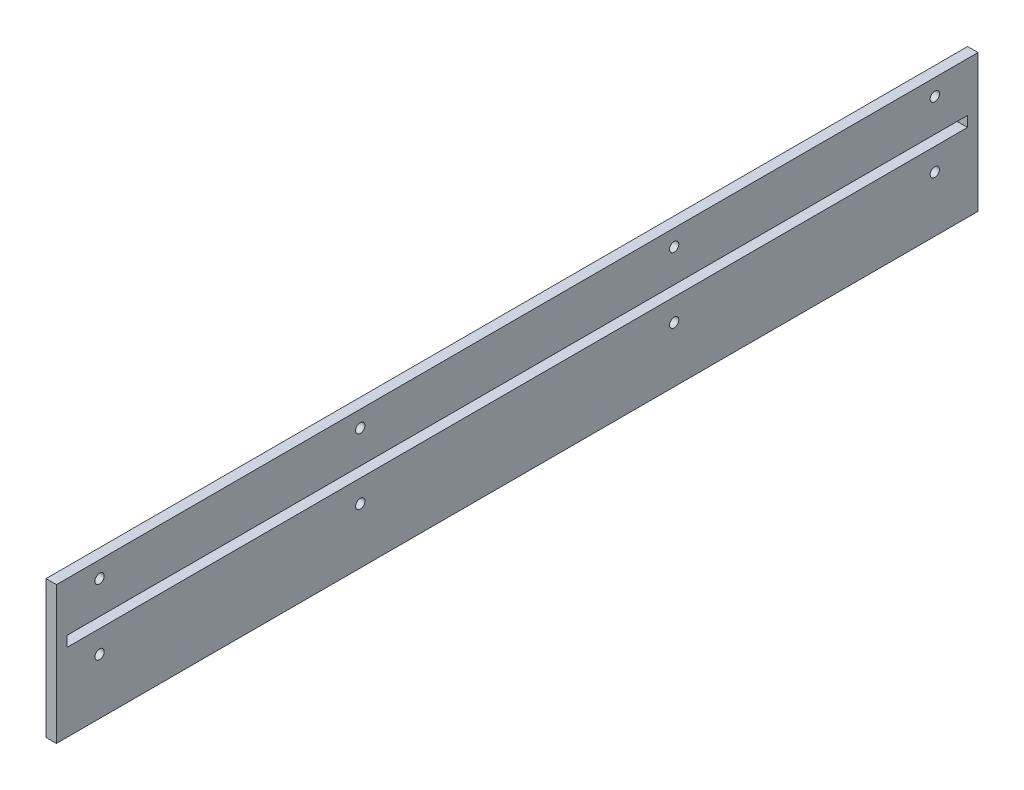
from build123d import *

# Parameters (mm, degrees)
SKETCH1_W               = 281.36
SKETCH1_H               = 30
BOSS_EXTRUDE1_DEPTH     = 3.18
CUT_EXTRUDE1_REACH      = 143.513
SKETCH2_R               = 1.425
MIRROR2_COPY_1_REACH    = 143.513
MIRROR2_COPY_1_SKETCH_R = 1.425
SKETCH3_W               = 275
SKETCH3_H               = 3.19
CUT_EXTRUDE2_DEPTH      = 3.18
SKETCH4_W               = 3.18
SKETCH4_H               = 281.36
BOSS_EXTRUDE2_DEPTH     = 12


with BuildPart() as part:
    # Sketch1 → Boss-Extrude1 (new body)
    with BuildSketch(Plane(origin=(0, 0, 0), x_dir=(0, 0, -1), z_dir=(1, 0, 0))):
        Rectangle(SKETCH1_W, SKETCH1_H)
    extrude(amount=BOSS_EXTRUDE1_DEPTH)

    # Sketch2 → Cut-Extrude1 (cut, up to next)
    with BuildSketch(Plane.ZY, mode=Mode.PRIVATE) as cut_extrude1_sk1:
        with Locations((-127.5, 10)):
            Circle(SKETCH2_R)
    cut_extrude1_tool1 = extrude(cut_extrude1_sk1.sketch, amount=-CUT_EXTRUDE1_REACH, mode=Mode.PRIVATE) & part.part
    # Sketch2 → Cut-Extrude1 (cut, up to next)
    with BuildSketch(Plane.ZY, mode=Mode.PRIVATE) as cut_extrude1_sk2:
        with Locations((-47.91, 10)):
            Circle(SKETCH2_R)
    cut_extrude1_tool2 = extrude(cut_extrude1_sk2.sketch, amount=-CUT_EXTRUDE1_REACH, mode=Mode.PRIVATE) & part.part
    cut_extrude1_1 = cut_extrude1_tool1.solids().sort_by_distance((0, 10, -127.5))[0]
    add(cut_extrude1_1, mode=Mode.SUBTRACT)
    cut_extrude1_2 = cut_extrude1_tool2.solids().sort_by_distance((0, 10, -47.91))[0]
    add(cut_extrude1_2, mode=Mode.SUBTRACT)
    cut_extrude1 = cut_extrude1_1 + cut_extrude1_2  # Cut-Extrude1 as one shape, for the pattern or mirror that repeats it

    # Mirror1: Cut-Extrude1 across plane
    add(cut_extrude1.mirror(Plane.ZX), mode=Mode.SUBTRACT)

    # Mirror2: Cut-Extrude1 across plane
    add(cut_extrude1.mirror(Plane.XY), mode=Mode.SUBTRACT)

    # Mirror2 copy 1 sketch → Mirror2 copy 1 (cut, up to next)
    with BuildSketch(Plane(origin=(0, 0, 0), x_dir=(0, 0, -1), z_dir=(-1, 0, 0)), mode=Mode.PRIVATE) as mirror2_copy_1_sk1:
        with Locations((-127.5, 10)):
            Circle(MIRROR2_COPY_1_SKETCH_R)
    mirror2_copy_1_tool1 = extrude(mirror2_copy_1_sk1.sketch, amount=-MIRROR2_COPY_1_REACH, mode=Mode.PRIVATE) & part.part
    # Mirror2 copy 1 sketch → Mirror2 copy 1 (cut, up to next)
    with BuildSketch(Plane(origin=(0, 0, 0), x_dir=(0, 0, -1), z_dir=(-1, 0, 0)), mode=Mode.PRIVATE) as mirror2_copy_1_sk2:
        with Locations((-47.91, 10)):
            Circle(MIRROR2_COPY_1_SKETCH_R)
    mirror2_copy_1_tool2 = extrude(mirror2_copy_1_sk2.sketch, amount=-MIRROR2_COPY_1_REACH, mode=Mode.PRIVATE) & part.part
    add(mirror2_copy_1_tool1.solids().sort_by_distance((0, -10, 127.5))[0], mode=Mode.SUBTRACT)
    add(mirror2_copy_1_tool2.solids().sort_by_distance((0, -10, 47.91))[0], mode=Mode.SUBTRACT)

    # Sketch3 → Cut-Extrude2 (cut)
    with BuildSketch(Plane(origin=(3.18, 0, 0), x_dir=(0, 0, -1), z_dir=(1, 0, 0))):
        with Locations((0, -1.615)):
            Rectangle(SKETCH3_W, SKETCH3_H)
    extrude(amount=-CUT_EXTRUDE2_DEPTH, mode=Mode.SUBTRACT)

    # Sketch4 → Boss-Extrude2 (add)
    with BuildSketch(Plane.XZ.offset(15)):
        with Locations((1.59, 0)):
            Rectangle(SKETCH4_W, SKETCH4_H)
    extrude(amount=BOSS_EXTRUDE2_DEPTH)


solid = part.part
